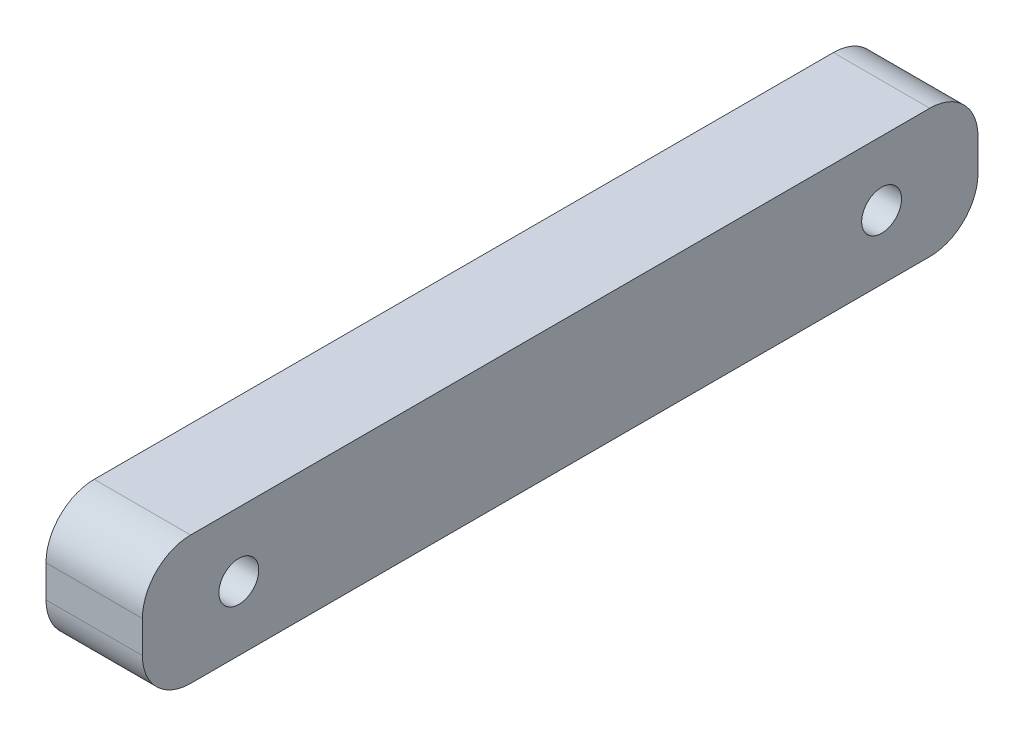
from build123d import *

# Parameters (mm, degrees)
SKETCH1_R           = 3.937
BOSS_EXTRUDE1_DEPTH = 19.05


with BuildPart() as part:
    # Sketch1 → Boss-Extrude1 (new body)
    with BuildSketch(Plane(origin=(0, 0, 0), x_dir=(0, 0, -1), z_dir=(1, 0, 0))):
        with BuildLine():
            Line((9.525, 0), (155.575, 0))
            ThreePointArc((155.575, 0), (162.310192091, -2.789807909), (165.1, -9.525))
            Line((165.1, -9.525), (165.1, -15.875))
            ThreePointArc((165.1, -15.875), (162.310192091, -22.610192091), (155.575, -25.4))
            Line((155.575, -25.4), (9.525, -25.4))
            ThreePointArc((9.525, -25.4), (2.789807909, -22.610192091), (0, -15.875))
            Line((0, -15.875), (0, -9.525))
            ThreePointArc((0, -9.525), (2.789807909, -2.789807909), (9.525, 0))
        make_face()
        with Locations(Location((19.05, -12.7, 0), (0, 0, 180))):
            Circle(SKETCH1_R, mode=Mode.SUBTRACT)
        with Locations(Location((146.05, -12.7, 0), (0, 0, 180))):
            Circle(SKETCH1_R, mode=Mode.SUBTRACT)
    extrude(amount=BOSS_EXTRUDE1_DEPTH)


solid = part.part
